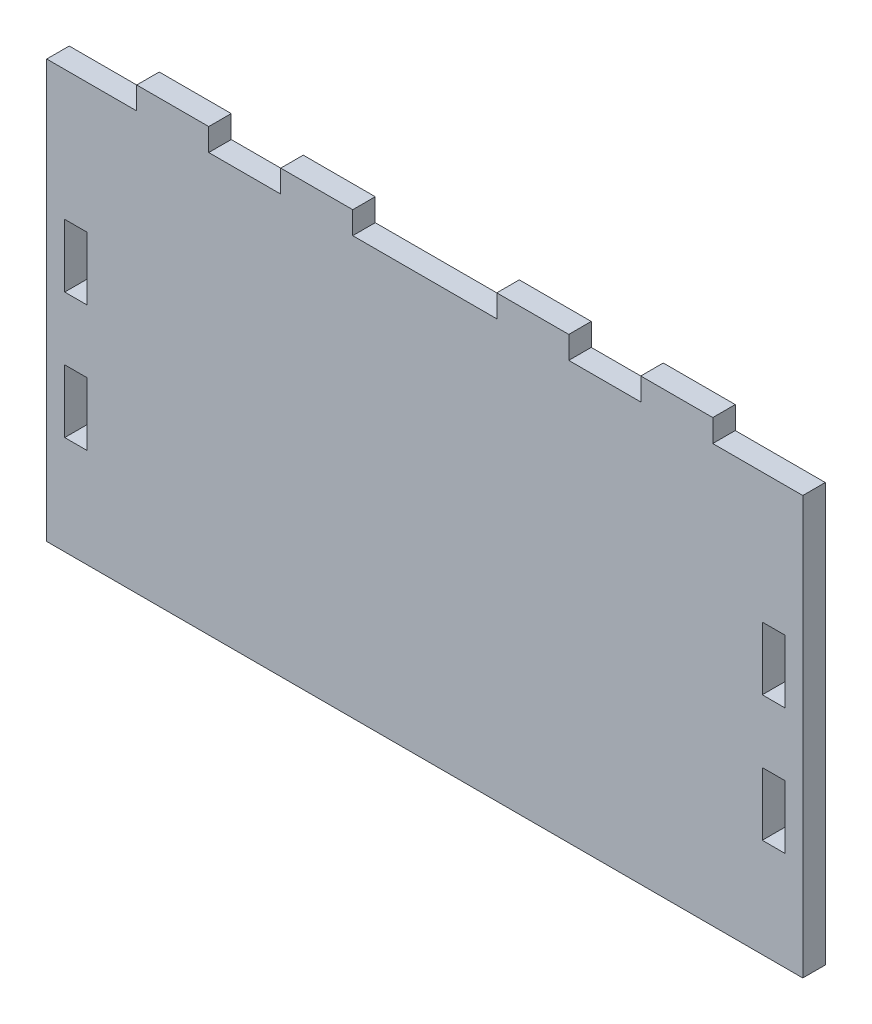
from build123d import *

# Parameters (mm, degrees)
SKETCH1_W           = 2.5
SKETCH1_H           = 7
BOSS_EXTRUDE1_DEPTH = 2.5


with BuildPart() as part:
    # Sketch1 → Boss-Extrude1 (new body)
    with BuildSketch(Plane.XY):
        Polygon((-16, 21.9632035), (-16, 24.4632035), (-8, 24.4632035), (-8, 21.9632035), (8, 21.9632035), (8, 24.4632035), (16, 24.4632035), (16, 21.9632035), (24, 21.9632035), (24, 24.4632035), (32, 24.4632035), (32, 21.9632035), (42, 21.9632035), (42, -24.4632035), (-42, -24.4632035), (-42, 21.9632035), (-32, 21.9632035), (-32, 24.4632035), (-24, 24.4632035), (-24, 21.9632035), align=None)
        with Locations((-38.75, 4.0367965)):
            Rectangle(SKETCH1_W, SKETCH1_H, mode=Mode.SUBTRACT)
        with Locations((-38.75, -9.9632035)):
            Rectangle(SKETCH1_W, SKETCH1_H, mode=Mode.SUBTRACT)
        with Locations((38.75, -9.9632035)):
            Rectangle(SKETCH1_W, SKETCH1_H, mode=Mode.SUBTRACT)
        with Locations((38.75, 4.0367965)):
            Rectangle(SKETCH1_W, SKETCH1_H, mode=Mode.SUBTRACT)
    extrude(amount=BOSS_EXTRUDE1_DEPTH)


solid = part.part
